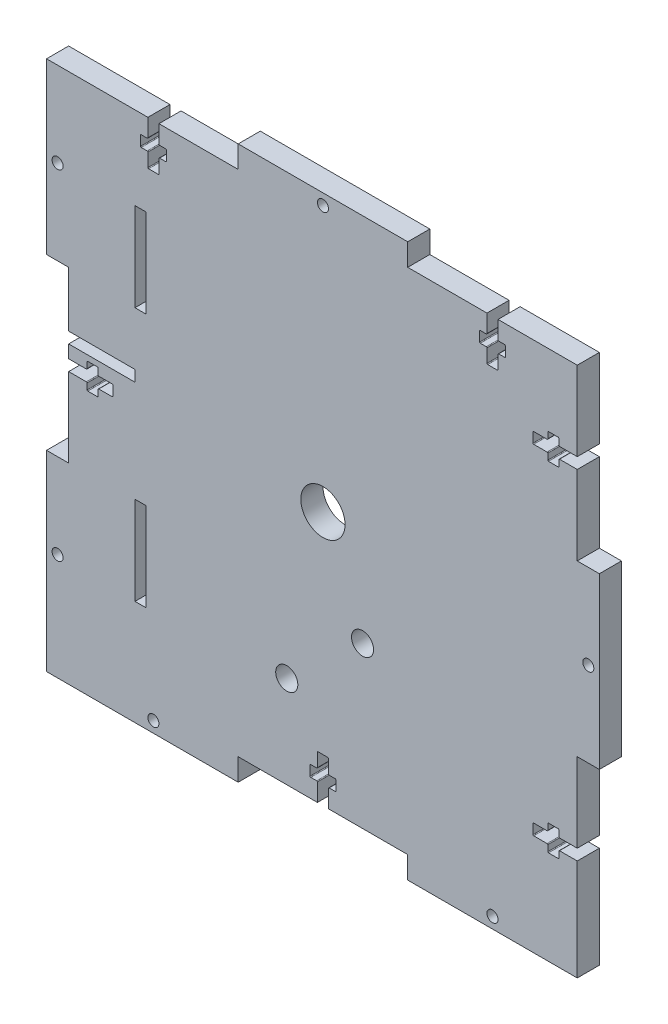
from build123d import *

# Parameters (mm, degrees)
BOX_SIDE_DEPTH           = 6
SKETCH2_R                = 1.5
SCREW_CUT_OUTS_DEPTH     = 107.235587258
SKETCH3_R                = 6
BEARINGHOLE_DEPTH        = 107.235587258
SKETCH4_W                = 18
SKETCH4_H                = 3
SKETCH4_W_2              = 3
SKETCH4_H_2              = 24
GROOVES_DEPTH            = 6
SKETCH5_R                = 3
CLOCKWISESHAFTHOLE_DEPTH = 107.235587258
SKETCH6_R                = 3
CUT_EXTRUDE1_DEPTH       = 107.235587258


with BuildPart() as part:
    # Sketch1 → Box Side (new body)
    with BuildSketch(Plane.XY):
        Polygon((-69, 69), (-23, 69), (-23, 75), (23, 75), (23, 69), (69, 69), (69, 23), (75, 23), (75, -23), (69, -23), (69, -69), (69, -75), (23, -75), (23, -69), (-23, -69), (-23, -75), (-69, -75), (-75, -75), (-75, -69), (-75, -23), (-69, -23), (-69, 23), (-75, 23), (-75, 69), align=None)
    extrude(amount=BOX_SIDE_DEPTH)

    # Sketch2 → Screw Cut-outs (cut, through all)
    with BuildSketch(Plane.XY.offset(6)):
        with Locations((0, 72)):
            Circle(SKETCH2_R)
        with Locations(Location((72, 0, 0), (0, 0, 180))):
            Circle(SKETCH2_R)
        with Locations((-46, -72)):
            Circle(SKETCH2_R)
        with Locations(Location((46, -72, 0), (0, 0, 180))):
            Circle(SKETCH2_R)
        with Locations((-72, 46)):
            Circle(SKETCH2_R)
        with Locations(Location((-72, -46, 0), (0, 0, 180))):
            Circle(SKETCH2_R)
        with BuildLine():
            Line((-44.5, 69), (-44.5, 64.2))
            ThreePointArc((-44.5, 64.2), (-44.441421356, 64.058578644), (-44.3, 64))
            Line((-44.3, 64), (-42.7, 64))
            ThreePointArc((-42.7, 64), (-42.558578644, 63.941421356), (-42.5, 63.8))
            Line((-42.5, 63.8), (-42.5, 61.2))
            ThreePointArc((-42.5, 61.2), (-42.558578644, 61.058578644), (-42.7, 61))
            Line((-42.7, 61), (-44.3, 61))
            ThreePointArc((-44.3, 61), (-44.441421356, 60.941421356), (-44.5, 60.8))
            Line((-44.5, 60.8), (-44.5, 57.2))
            ThreePointArc((-44.5, 57.2), (-44.558578644, 57.058578644), (-44.7, 57))
            Line((-44.7, 57), (-47.3, 57))
            ThreePointArc((-47.3, 57), (-47.441421356, 57.058578644), (-47.5, 57.2))
            Line((-47.5, 57.2), (-47.5, 60.8))
            ThreePointArc((-47.5, 60.8), (-47.558578644, 60.941421356), (-47.7, 61))
            Line((-47.7, 61), (-49.3, 61))
            ThreePointArc((-49.3, 61), (-49.441421356, 61.058578644), (-49.5, 61.2))
            Line((-49.5, 61.2), (-49.5, 63.8))
            ThreePointArc((-49.5, 63.8), (-49.441421356, 63.941421356), (-49.3, 64))
            Line((-49.3, 64), (-47.7, 64))
            ThreePointArc((-47.7, 64), (-47.558578644, 64.058578644), (-47.5, 64.2))
            Line((-47.5, 64.2), (-47.5, 69))
            Line((-47.5, 69), (-44.5, 69))
        make_face()
        with BuildLine():
            Line((47.5, 69), (47.5, 64.2))
            ThreePointArc((47.5, 64.2), (47.558578644, 64.058578644), (47.7, 64))
            Line((47.7, 64), (49.3, 64))
            ThreePointArc((49.3, 64), (49.441421356, 63.941421356), (49.5, 63.8))
            Line((49.5, 63.8), (49.5, 61.2))
            ThreePointArc((49.5, 61.2), (49.441421356, 61.058578644), (49.3, 61))
            Line((49.3, 61), (47.7, 61))
            ThreePointArc((47.7, 61), (47.558578644, 60.941421356), (47.5, 60.8))
            Line((47.5, 60.8), (47.5, 57.2))
            ThreePointArc((47.5, 57.2), (47.441421356, 57.058578644), (47.3, 57))
            Line((47.3, 57), (44.7, 57))
            ThreePointArc((44.7, 57), (44.558578644, 57.058578644), (44.5, 57.2))
            Line((44.5, 57.2), (44.5, 60.8))
            ThreePointArc((44.5, 60.8), (44.441421356, 60.941421356), (44.3, 61))
            Line((44.3, 61), (42.7, 61))
            ThreePointArc((42.7, 61), (42.558578644, 61.058578644), (42.5, 61.2))
            Line((42.5, 61.2), (42.5, 63.8))
            ThreePointArc((42.5, 63.8), (42.558578644, 63.941421356), (42.7, 64))
            Line((42.7, 64), (44.3, 64))
            ThreePointArc((44.3, 64), (44.441421356, 64.058578644), (44.5, 64.2))
            Line((44.5, 64.2), (44.5, 69))
            Line((44.5, 69), (47.5, 69))
        make_face()
        with BuildLine():
            Line((69, 44.5), (64.2, 44.5))
            ThreePointArc((64.2, 44.5), (64.058578644, 44.441421356), (64, 44.3))
            Line((64, 44.3), (64, 42.7))
            ThreePointArc((64, 42.7), (63.941421356, 42.558578644), (63.8, 42.5))
            Line((63.8, 42.5), (61.2, 42.5))
            ThreePointArc((61.2, 42.5), (61.058578644, 42.558578644), (61, 42.7))
            Line((61, 42.7), (61, 44.3))
            ThreePointArc((61, 44.3), (60.941421356, 44.441421356), (60.8, 44.5))
            Line((60.8, 44.5), (57.2, 44.5))
            ThreePointArc((57.2, 44.5), (57.058578644, 44.558578644), (57, 44.7))
            Line((57, 44.7), (57, 47.3))
            ThreePointArc((57, 47.3), (57.058578644, 47.441421356), (57.2, 47.5))
            Line((57.2, 47.5), (60.8, 47.5))
            ThreePointArc((60.8, 47.5), (60.941421356, 47.558578644), (61, 47.7))
            Line((61, 47.7), (61, 49.3))
            ThreePointArc((61, 49.3), (61.058578644, 49.441421356), (61.2, 49.5))
            Line((61.2, 49.5), (63.8, 49.5))
            ThreePointArc((63.8, 49.5), (63.941421356, 49.441421356), (64, 49.3))
            Line((64, 49.3), (64, 47.7))
            ThreePointArc((64, 47.7), (64.058578644, 47.558578644), (64.2, 47.5))
            Line((64.2, 47.5), (69, 47.5))
            Line((69, 47.5), (69, 44.5))
        make_face()
        with BuildLine():
            Line((69, -47.5), (64.2, -47.5))
            ThreePointArc((64.2, -47.5), (64.058578644, -47.558578644), (64, -47.7))
            Line((64, -47.7), (64, -49.3))
            ThreePointArc((64, -49.3), (63.941421356, -49.441421356), (63.8, -49.5))
            Line((63.8, -49.5), (61.2, -49.5))
            ThreePointArc((61.2, -49.5), (61.058578644, -49.441421356), (61, -49.3))
            Line((61, -49.3), (61, -47.7))
            ThreePointArc((61, -47.7), (60.941421356, -47.558578644), (60.8, -47.5))
            Line((60.8, -47.5), (57.2, -47.5))
            ThreePointArc((57.2, -47.5), (57.058578644, -47.441421356), (57, -47.3))
            Line((57, -47.3), (57, -44.7))
            ThreePointArc((57, -44.7), (57.058578644, -44.558578644), (57.2, -44.5))
            Line((57.2, -44.5), (60.8, -44.5))
            ThreePointArc((60.8, -44.5), (60.941421356, -44.441421356), (61, -44.3))
            Line((61, -44.3), (61, -42.7))
            ThreePointArc((61, -42.7), (61.058578644, -42.558578644), (61.2, -42.5))
            Line((61.2, -42.5), (63.8, -42.5))
            ThreePointArc((63.8, -42.5), (63.941421356, -42.558578644), (64, -42.7))
            Line((64, -42.7), (64, -44.3))
            ThreePointArc((64, -44.3), (64.058578644, -44.441421356), (64.2, -44.5))
            Line((64.2, -44.5), (69, -44.5))
            Line((69, -44.5), (69, -47.5))
        make_face()
        with BuildLine():
            Line((-1.5, -69), (1.5, -69))
            Line((1.5, -69), (1.5, -64.2))
            ThreePointArc((1.5, -64.2), (1.558578644, -64.058578644), (1.7, -64))
            Line((1.7, -64), (3.3, -64))
            ThreePointArc((3.3, -64), (3.441421356, -63.941421356), (3.5, -63.8))
            Line((3.5, -63.8), (3.5, -61.2))
            ThreePointArc((3.5, -61.2), (3.441421356, -61.058578644), (3.3, -61))
            Line((3.3, -61), (1.7, -61))
            ThreePointArc((1.7, -61), (1.558578644, -60.941421356), (1.5, -60.8))
            Line((1.5, -60.8), (1.5, -57.2))
            ThreePointArc((1.5, -57.2), (1.441421356, -57.058578644), (1.3, -57))
            Line((1.3, -57), (-1.3, -57))
            ThreePointArc((-1.3, -57), (-1.441421356, -57.058578644), (-1.5, -57.2))
            Line((-1.5, -57.2), (-1.5, -60.8))
            ThreePointArc((-1.5, -60.8), (-1.558578644, -60.941421356), (-1.7, -61))
            Line((-1.7, -61), (-3.3, -61))
            ThreePointArc((-3.3, -61), (-3.441421356, -61.058578644), (-3.5, -61.2))
            Line((-3.5, -61.2), (-3.5, -63.8))
            ThreePointArc((-3.5, -63.8), (-3.441421356, -63.941421356), (-3.3, -64))
            Line((-3.3, -64), (-1.7, -64))
            ThreePointArc((-1.7, -64), (-1.558578644, -64.058578644), (-1.5, -64.2))
            Line((-1.5, -64.2), (-1.5, -69))
        make_face()
        with BuildLine():
            Line((-69, -1.5), (-64.2, -1.5))
            ThreePointArc((-64.2, -1.5), (-64.058578644, -1.558578644), (-64, -1.7))
            Line((-64, -1.7), (-64, -3.3))
            ThreePointArc((-64, -3.3), (-63.941421356, -3.441421356), (-63.8, -3.5))
            Line((-63.8, -3.5), (-61.2, -3.5))
            ThreePointArc((-61.2, -3.5), (-61.058578644, -3.441421356), (-61, -3.3))
            Line((-61, -3.3), (-61, -1.7))
            ThreePointArc((-61, -1.7), (-60.941421356, -1.558578644), (-60.8, -1.5))
            Line((-60.8, -1.5), (-57.2, -1.5))
            ThreePointArc((-57.2, -1.5), (-57.058578644, -1.441421356), (-57, -1.3))
            Line((-57, -1.3), (-57, 1.3))
            ThreePointArc((-57, 1.3), (-57.058578644, 1.441421356), (-57.2, 1.5))
            Line((-57.2, 1.5), (-60.8, 1.5))
            ThreePointArc((-60.8, 1.5), (-60.941421356, 1.558578644), (-61, 1.7))
            Line((-61, 1.7), (-61, 3.3))
            ThreePointArc((-61, 3.3), (-61.058578644, 3.441421356), (-61.2, 3.5))
            Line((-61.2, 3.5), (-63.8, 3.5))
            ThreePointArc((-63.8, 3.5), (-63.941421356, 3.441421356), (-64, 3.3))
            Line((-64, 3.3), (-64, 1.7))
            ThreePointArc((-64, 1.7), (-64.058578644, 1.558578644), (-64.2, 1.5))
            Line((-64.2, 1.5), (-69, 1.5))
            Line((-69, 1.5), (-69, -1.5))
        make_face()
    extrude(amount=-SCREW_CUT_OUTS_DEPTH, mode=Mode.SUBTRACT)

    # Sketch3 → BearingHole (cut, through all)
    with BuildSketch(Plane.XY.offset(6)):
        Circle(SKETCH3_R)
    extrude(amount=-BEARINGHOLE_DEPTH, mode=Mode.SUBTRACT)

    # Sketch4 → Grooves (cut)
    with BuildSketch(Plane.XY.offset(6)):
        with Locations((-60, 6.5)):
            Rectangle(SKETCH4_W, SKETCH4_H)
        with Locations((-49.5, 34.5)):
            Rectangle(SKETCH4_W_2, SKETCH4_H_2)
        with Locations((-49.5, -34.5)):
            Rectangle(SKETCH4_W_2, SKETCH4_H_2)
    extrude(amount=-GROOVES_DEPTH, mode=Mode.SUBTRACT)

    # Sketch5 → clockwiseShaftHole (cut, through all)
    with BuildSketch(Plane.XY.offset(6)):
        with Locations((-9.82, -44)):
            Circle(SKETCH5_R)
    extrude(amount=-CLOCKWISESHAFTHOLE_DEPTH, mode=Mode.SUBTRACT)

    # Sketch6 → Cut-Extrude1 (cut, through all)
    with BuildSketch(Plane(origin=(0, 0, 0), x_dir=(-1, 0, 0), z_dir=(0, 0, -1))):
        with Locations((-10.75, -25.5)):
            Circle(SKETCH6_R)
    extrude(amount=-CUT_EXTRUDE1_DEPTH, mode=Mode.SUBTRACT)


solid = part.part
